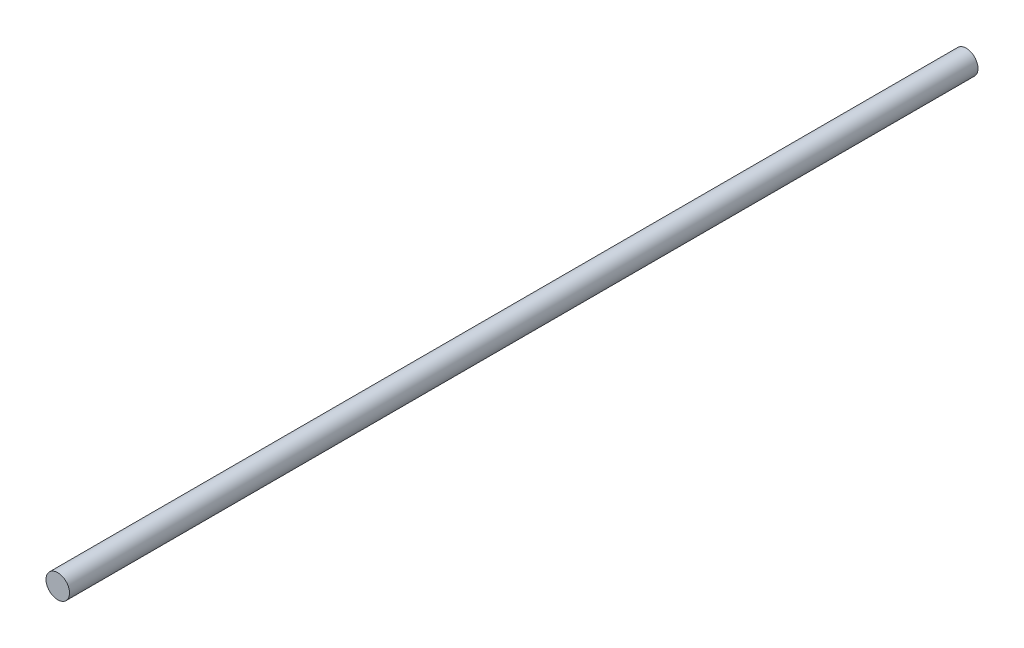
from build123d import *

# Parameters (mm, degrees)
CROQUIS1_R              = 3.175
SALIENTE_EXTRUIR1_DEPTH = 245


with BuildPart() as part:
    # Croquis1 → Saliente-Extruir1 (new body)
    with BuildSketch(Plane.XY):
        Circle(CROQUIS1_R)
    extrude(amount=SALIENTE_EXTRUIR1_DEPTH)


solid = part.part
